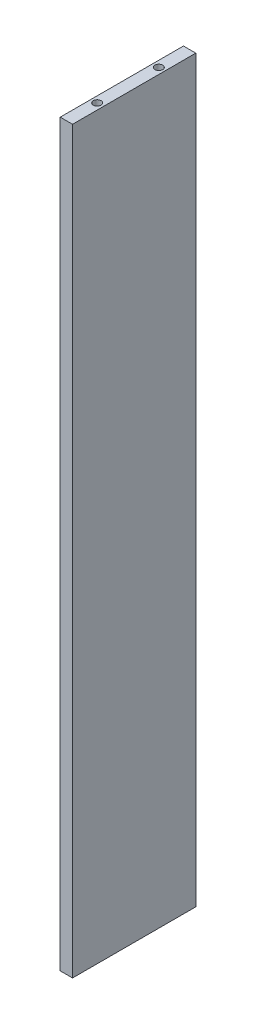
from build123d import *

# Parameters (mm, degrees)
SKETCH1_W                  = 6.35
SKETCH1_H                  = 63.5
BOSS_EXTRUDE1_DEPTH        = 381
F_10_32_TAPPED_HOLE1_D     = 4.0386
F_10_32_TAPPED_HOLE1_DEPTH = 12.1
F_10_32_TAPPED_HOLE1_TIP   = 1.213317848
F_10_32_TAPPED_HOLE2_D     = 4.0386
F_10_32_TAPPED_HOLE2_DEPTH = 13.7
F_10_32_TAPPED_HOLE2_TIP   = 1.213317848


with BuildPart() as part:
    # Sketch1 → Boss-Extrude1 (new body)
    with BuildSketch(Plane(origin=(0, 0, 0), x_dir=(1, 0, 0), z_dir=(0, 1, 0))):
        with Locations((3.614938025, 26.308652781)):
            Rectangle(SKETCH1_W, SKETCH1_H)
    extrude(amount=BOSS_EXTRUDE1_DEPTH)

    # #10-32 Tapped Hole1
    with Locations(Plane(origin=(3.614938025, 381, -42.183652781), x_dir=(0, 0, 1), z_dir=(0, 1, 0))):
        with Locations((0, 0), (31.75, 0)):
            Hole(F_10_32_TAPPED_HOLE1_D / 2, depth=F_10_32_TAPPED_HOLE1_DEPTH)
            with Locations((0, 0, -(F_10_32_TAPPED_HOLE1_DEPTH + F_10_32_TAPPED_HOLE1_TIP / 2))):  # 118° drill point
                Cone(0, F_10_32_TAPPED_HOLE1_D / 2, F_10_32_TAPPED_HOLE1_TIP, mode=Mode.SUBTRACT)

    # #10-32 Tapped Hole2
    with Locations(Plane(origin=(3.614938025, 0, -10.433652781), x_dir=(0, 0, -1), z_dir=(0, -1, 0))):
        with Locations((0, 0), (31.75, 0)):
            Hole(F_10_32_TAPPED_HOLE2_D / 2, depth=F_10_32_TAPPED_HOLE2_DEPTH)
            with Locations((0, 0, -(F_10_32_TAPPED_HOLE2_DEPTH + F_10_32_TAPPED_HOLE2_TIP / 2))):  # 118° drill point
                Cone(0, F_10_32_TAPPED_HOLE2_D / 2, F_10_32_TAPPED_HOLE2_TIP, mode=Mode.SUBTRACT)


solid = part.part
